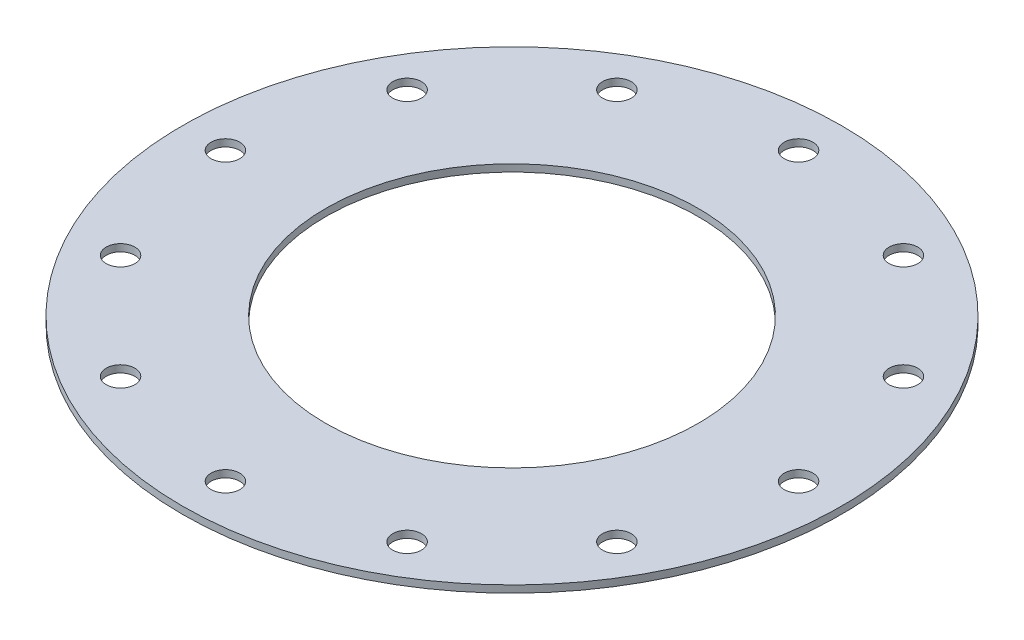
from build123d import *

# Parameters (mm, degrees)
SKETCH2_R           = 115
SKETCH2_R_2         = 5
SKETCH2_R_3         = 65
BOSS_EXTRUDE1_DEPTH = 2.5


with BuildPart() as part:
    # Sketch2 → Boss-Extrude1 (new body)
    with BuildSketch(Plane(origin=(0, 0, 0), x_dir=(1, 0, 0), z_dir=(0, 1, 0))):
        with Locations(Location((0, 0, 0), (0, 0, 270))):
            Circle(SKETCH2_R)
        with Locations(Location((0, 100, 0), (0, 0, 270))):
            Circle(SKETCH2_R_2, mode=Mode.SUBTRACT)
        with Locations(Location((50, 86.602540378, 0), (0, 0, 270))):
            Circle(SKETCH2_R_2, mode=Mode.SUBTRACT)
        with Locations(Location((86.602540378, 50, 0), (0, 0, 270))):
            Circle(SKETCH2_R_2, mode=Mode.SUBTRACT)
        with Locations(Location((100, 0, 0), (0, 0, 270))):
            Circle(SKETCH2_R_2, mode=Mode.SUBTRACT)
        with Locations(Location((86.602540378, -50, 0), (0, 0, 270))):
            Circle(SKETCH2_R_2, mode=Mode.SUBTRACT)
        with Locations(Location((50, -86.602540378, 0), (0, 0, 270))):
            Circle(SKETCH2_R_2, mode=Mode.SUBTRACT)
        with Locations(Location((0, -100, 0), (0, 0, 270))):
            Circle(SKETCH2_R_2, mode=Mode.SUBTRACT)
        with Locations(Location((-50, -86.602540378, 0), (0, 0, 270))):
            Circle(SKETCH2_R_2, mode=Mode.SUBTRACT)
        with Locations(Location((-86.602540378, -50, 0), (0, 0, 270))):
            Circle(SKETCH2_R_2, mode=Mode.SUBTRACT)
        with Locations(Location((-100, 0, 0), (0, 0, 270))):
            Circle(SKETCH2_R_2, mode=Mode.SUBTRACT)
        with Locations(Location((-86.602540378, 50, 0), (0, 0, 270))):
            Circle(SKETCH2_R_2, mode=Mode.SUBTRACT)
        with Locations(Location((-50, 86.602540378, 0), (0, 0, 270))):
            Circle(SKETCH2_R_2, mode=Mode.SUBTRACT)
        with Locations(Location((0, 0, 0), (0, 0, 270))):
            Circle(SKETCH2_R_3, mode=Mode.SUBTRACT)
    extrude(amount=BOSS_EXTRUDE1_DEPTH)


solid = part.part
